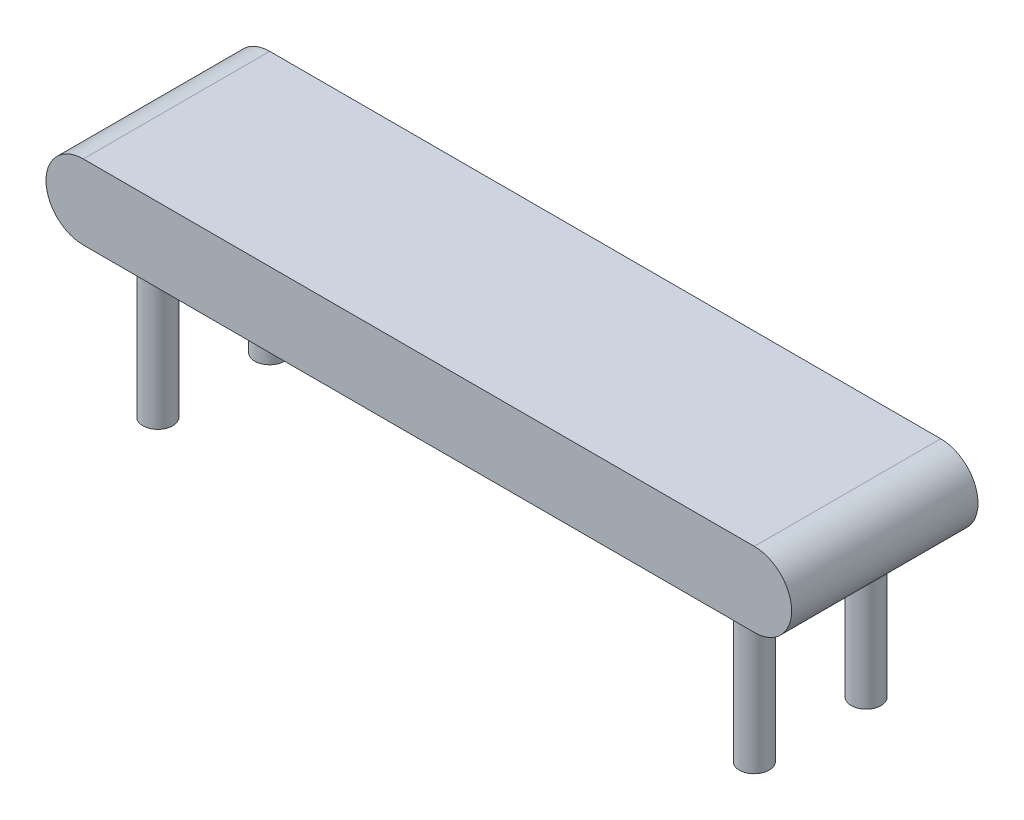
from build123d import *

# Parameters (mm, degrees)
SKETCH1_W           = 1000
SKETCH1_H           = 250
BOSS_EXTRUDE1_DEPTH = 100
CUT_EXTRUDE1_DEPTH  = 568.89083458
SKETCH3_R           = 20
BOSS_EXTRUDE2_DEPTH = 200


with BuildPart() as part:
    # Sketch1 → Boss-Extrude1 (new body)
    with BuildSketch(Plane(origin=(0, 0, 0), x_dir=(1, 0, 0), z_dir=(0, 1, 0))):
        Rectangle(SKETCH1_W, SKETCH1_H)
    extrude(amount=BOSS_EXTRUDE1_DEPTH)

    # Sketch2 → Cut-Extrude1 (cut, through all)
    with BuildSketch(Plane.XY.offset(125)):
        with BuildLine():
            ThreePointArc((-500, 50), (-485.355339059, 85.355339059), (-450, 100))
            Line((-450, 100), (-500, 100))
            Line((-500, 100), (-500, 50))
        make_face()
        with BuildLine():
            ThreePointArc((-450, 0), (-485.355339059, 14.644660941), (-500, 50))
            Line((-500, 50), (-500, 0))
            Line((-500, 0), (-450, 0))
        make_face()
        with BuildLine():
            Line((500, 100), (450, 100))
            ThreePointArc((450, 100), (485.355339059, 85.355339059), (500, 50))
            Line((500, 50), (500, 100))
        make_face()
        with BuildLine():
            Line((500, 0), (500, 50))
            ThreePointArc((500, 50), (485.355339059, 14.644660941), (450, 0))
            Line((450, 0), (500, 0))
        make_face()
    extrude(amount=-CUT_EXTRUDE1_DEPTH, mode=Mode.SUBTRACT)

    # Sketch3 → Boss-Extrude2 (add)
    with BuildSketch(Plane.XZ):
        with Locations(Location((-400, 75, 0), (0, 0, 270))):
            Circle(SKETCH3_R)
        with Locations(Location((400, 75, 0), (0, 0, 90))):
            Circle(SKETCH3_R)
        with Locations(Location((400, -75, 0), (0, 0, 270))):
            Circle(SKETCH3_R)
        with Locations(Location((-400, -75, 0), (0, 0, 90))):
            Circle(SKETCH3_R)
    extrude(amount=BOSS_EXTRUDE2_DEPTH)


solid = part.part
